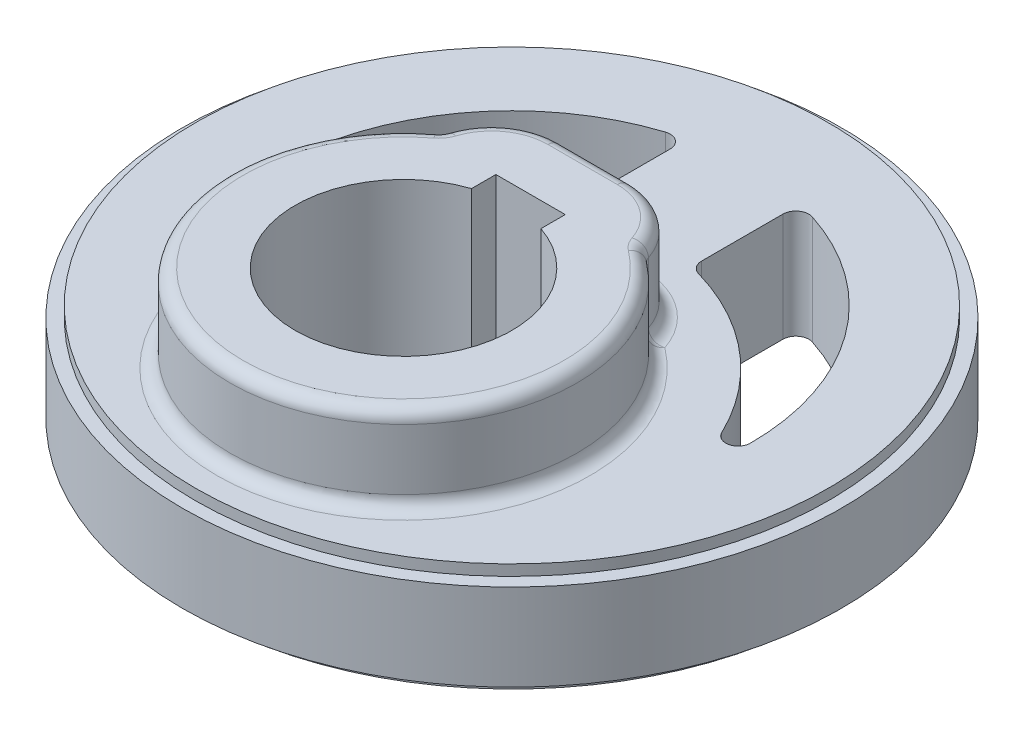
from build123d import *

# Parameters (mm, degrees)
SKETCH1_R                = 73
BOSS_EXTRUDE1_DEPTH      = 12.5
SKETCH1_3_R              = 76
SKETCH1_3_R_2            = 73
BOSS_EXTRUDE2_DEPTH      = 10
BOSS_EXTRUDE3_DEPTH      = 32.5
BOSS_EXTRUDE3_DEPTH_BACK = 12.5
FILLET1_R                = 3


with BuildPart() as part:
    # Sketch1 → Boss-Extrude1 (new, symmetric)
    with BuildSketch(Plane(origin=(0, 0, 0), x_dir=(1, 0, 0), z_dir=(0, 1, 0))):
        Circle(SKETCH1_R)
        with BuildLine():
            ThreePointArc((-23.467803367, 7.392317069), (-17.76019792, 15.978270251), (-8, 19.3))
            Line((-8, 19.3), (8, 19.3))
            ThreePointArc((8, 19.3), (17.76019792, 15.978270251), (23.467803367, 7.392317069))
            ThreePointArc((23.467803367, 7.392317069), (0, -65), (-23.467803367, 7.392317069))
        make_face(mode=Mode.SUBTRACT)
        with BuildLine():
            ThreePointArc((-16.923076923, 52.331725248), (-14.234954784, 51.903090128), (-13, 49.477267507))
            Line((-13, 49.477267507), (-13, 30.749439459))
            ThreePointArc((-13, 30.749439459), (-13.603882451, 28.944274456), (-15.172413793, 27.865847763))
            ThreePointArc((-15.172413793, 27.865847763), (-35.501955289, 17.007275211), (-49.597249509, -1.227897839))
            ThreePointArc((-49.597249509, -1.227897839), (-52.788696317, -2.770263795), (-55, 0))
            ThreePointArc((-55, 0), (-44.473414703, 32.359162298), (-16.923076923, 52.331725248))
        make_face(mode=Mode.SUBTRACT)
        with BuildLine():
            Line((13, 30.749439459), (13, 49.477267507))
            ThreePointArc((13, 49.477267507), (14.234954784, 51.903090128), (16.923076923, 52.331725248))
            ThreePointArc((16.923076923, 52.331725248), (44.473414703, 32.359162298), (55, 0))
            ThreePointArc((55, 0), (52.788696317, -2.770263795), (49.597249509, -1.227897839))
            ThreePointArc((49.597249509, -1.227897839), (35.501955289, 17.007275211), (15.172413793, 27.865847763))
            ThreePointArc((15.172413793, 27.865847763), (13.603882451, 28.944274456), (13, 30.749439459))
        make_face(mode=Mode.SUBTRACT)
    extrude(amount=BOSS_EXTRUDE1_DEPTH, both=True)

    # Sketch1<3> → Boss-Extrude2 (add, symmetric)
    with BuildSketch(Plane(origin=(0, 0, 0), x_dir=(1, 0, 0), z_dir=(0, 1, 0))):
        Circle(SKETCH1_3_R)
        Circle(SKETCH1_3_R_2, mode=Mode.SUBTRACT)
    extrude(amount=BOSS_EXTRUDE2_DEPTH, both=True)

    # Sketch1<4> → Boss-Extrude3 (add, two sides: drawn at the far end of the back side and taken through both)
    with BuildSketch(Plane(origin=(0, 0, 0), x_dir=(1, 0, 0), z_dir=(0, 1, 0)).offset(-BOSS_EXTRUDE3_DEPTH_BACK)):
        with BuildLine():
            Line((8, 19.3), (-8, 19.3))
            ThreePointArc((-8, 19.3), (-17.76019792, 15.978270251), (-23.467803367, 7.392317069))
            ThreePointArc((-23.467803367, 7.392317069), (0, -65), (23.467803367, 7.392317069))
            ThreePointArc((23.467803367, 7.392317069), (17.76019792, 15.978270251), (8, 19.3))
        make_face()
        with BuildLine():
            Line((-8, -1.314561435), (-8, 4.3))
            Line((-8, 4.3), (8, 4.3))
            Line((8, 4.3), (8, -1.314561435))
            ThreePointArc((8, -1.314561435), (0, -50), (-8, -1.314561435))
        make_face(mode=Mode.SUBTRACT)
    extrude(amount=BOSS_EXTRUDE3_DEPTH + BOSS_EXTRUDE3_DEPTH_BACK)

    # Fillet1
    fillet1_edges = [part.edges().sort_by_distance(p)[0] for p in [
        (-23.467803367, 22.5, -7.392317069),
        (23.467803367, 22.5, -7.392317069),
        (0, 12.5, -19.3),
        (-17.76019792, 12.5, -15.978270251),
        (0, 12.5, 65),
        (17.76019792, 12.5, -15.978270251),
        (-17.76019792, 32.5, -15.978270251),
        (17.76019792, 32.5, -15.978270251),
        (0, 32.5, 65),
        (0, 32.5, -19.3),
    ]]
    fillet(fillet1_edges, radius=FILLET1_R)


solid = part.part
